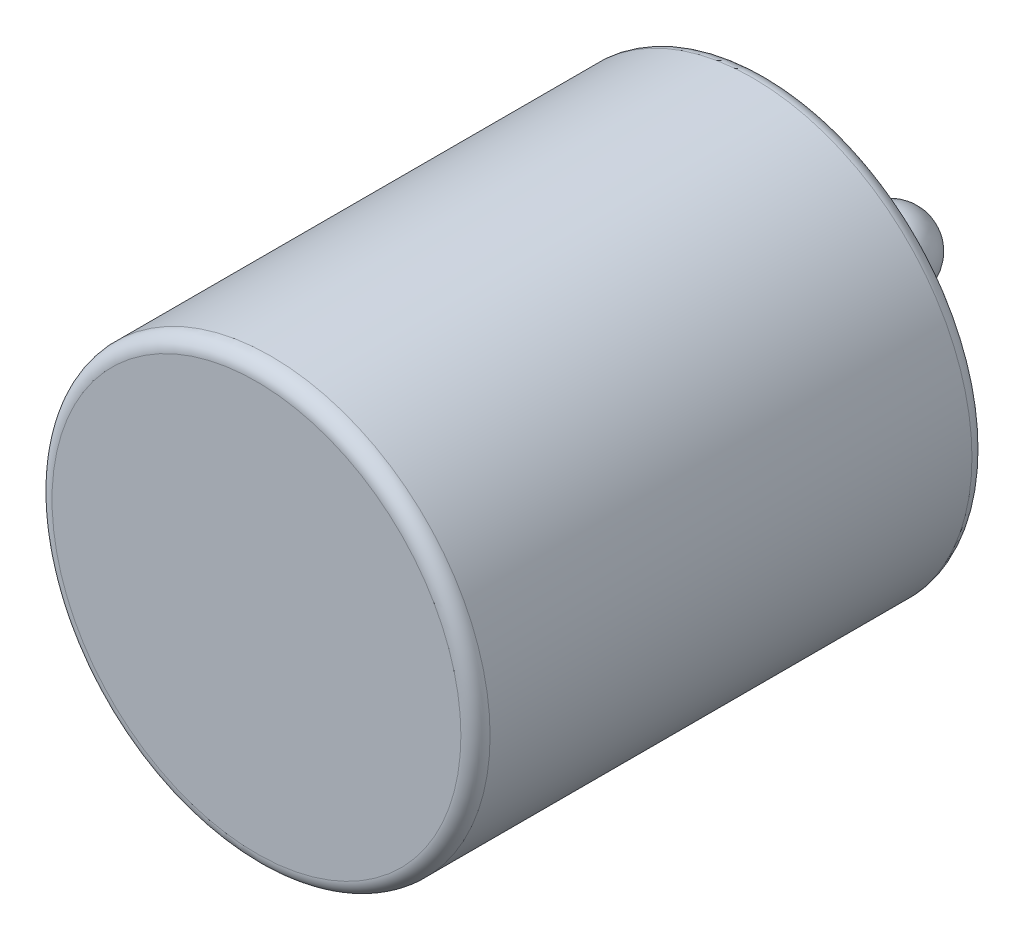
from build123d import *

# Parameters (mm, degrees)
SKETCH1_R           = 3
BOSS_EXTRUDE1_DEPTH = 7
FILLET2_R           = 0.2
FILLET3_R           = 0.2


with BuildPart() as part:
    # Sketch1 → Boss-Extrude1 (new body)
    with BuildSketch(Plane.XY):
        with Locations(Location((0, 0, 0), (0, 0, 180))):
            Circle(SKETCH1_R)
    extrude(amount=BOSS_EXTRUDE1_DEPTH)

    # Fillet2
    fillet2_edges = [part.edges().sort_by_distance(p)[0] for p in [
        (3, 0, 7),
    ]]
    fillet(fillet2_edges, radius=FILLET2_R)

    # Fillet3
    fillet3_edges = [part.edges().sort_by_distance(p)[0] for p in [
        (3, 0, 0),
    ]]
    fillet(fillet3_edges, radius=FILLET3_R)

    # Sketch4 → Revolve1 (revolve)
    with BuildSketch(Plane(origin=(0, 0, 0), x_dir=(1, 0, 0), z_dir=(0, 1, 0))):
        with BuildLine():
            Line((0, 0), (2.8, 0))
            Line((2.8, 0), (0.348733134, 1.30569363))
            ThreePointArc((0.348733134, 1.30569363), (0.479948636, 1.872008824), (0, 2.200002288))
            Line((0, 2.200002288), (0, 0))
        make_face()
    revolve(axis=Axis((0, 0, -5.421968799), (0, 0, 1)))


solid = part.part
